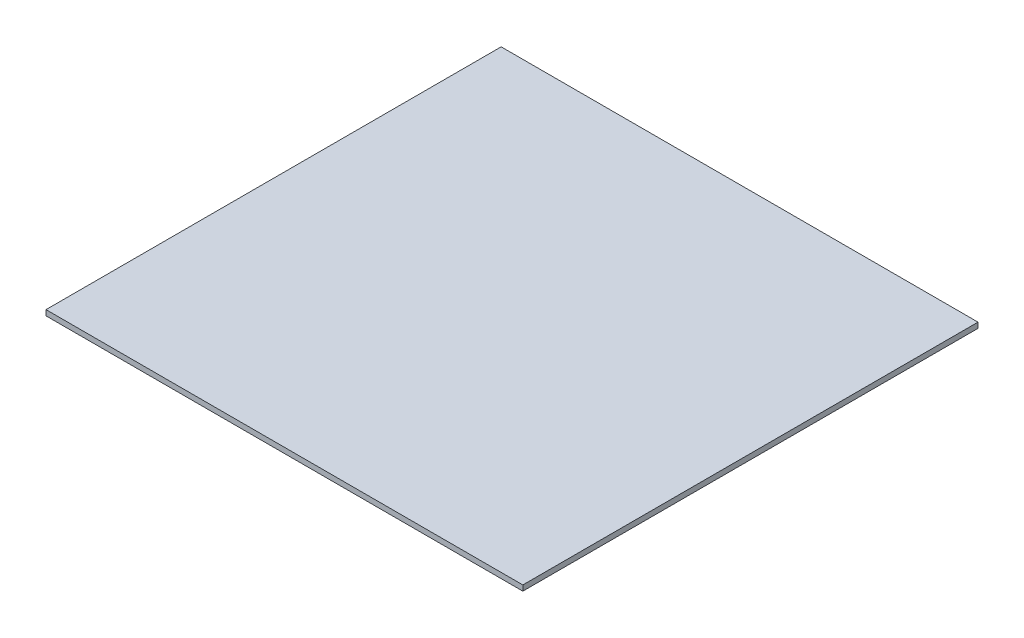
from build123d import *

# Parameters (mm, degrees)
SKETCH1_W           = 558.8
SKETCH1_H           = 533.4
BOSS_EXTRUDE1_DEPTH = 6.35


with BuildPart() as part:
    # Sketch1 → Boss-Extrude1 (new body)
    with BuildSketch(Plane(origin=(0, 0, 0), x_dir=(1, 0, 0), z_dir=(0, 1, 0))):
        Rectangle(SKETCH1_W, SKETCH1_H)
    extrude(amount=BOSS_EXTRUDE1_DEPTH)


solid = part.part
